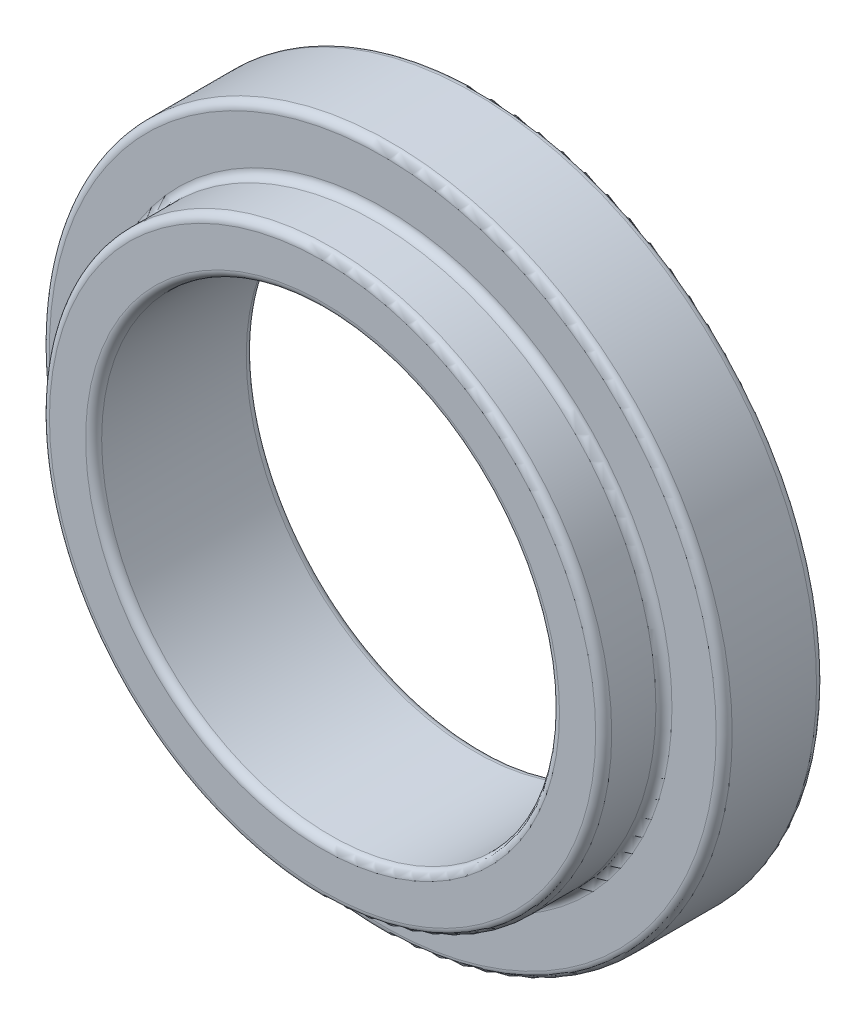
from build123d import *

# Parameters (mm, degrees)
SKETCH_1_R          = 85
EXTRUDE_1_DEPTH     = 40
SKETCH_2_R          = 57
CUT_EXTRUDE_1_DEPTH = 127.688594593
CUT_EXTRUDE_START   = -15
SKETCH_3_R          = 85
SKETCH_3_R_2        = 70
CUT_EXTRUDE_2_DEPTH = 15
FILLET_1_R          = 2


with BuildPart() as part:
    # 草图1 → 凸台-拉伸1 (new body)
    with BuildSketch(Plane.XY):
        Circle(SKETCH_1_R)
    extrude(amount=EXTRUDE_1_DEPTH)

    # 草图2 → 切除-拉伸1 (cut, through all)
    with BuildSketch(Plane.XY.offset(40)):
        Circle(SKETCH_2_R)
    extrude(amount=-CUT_EXTRUDE_1_DEPTH, mode=Mode.SUBTRACT)

    # 草图3 → 切除-拉伸2 (cut)
    with BuildSketch(Plane.XY.offset(40).offset(CUT_EXTRUDE_START)):
        Circle(SKETCH_3_R)
        Circle(SKETCH_3_R_2, mode=Mode.SUBTRACT)
    extrude(amount=CUT_EXTRUDE_2_DEPTH, mode=Mode.SUBTRACT)

    # 圆角1
    fillet_1_edges = [part.edges().sort_by_distance(p)[0] for p in [
        (-85, 0, 25),
        (-70, 0, 25),
        (-70, 0, 40),
        (-85, 0, 0),
        (-57, 0, 0),
        (-57, 0, 40),
    ]]
    fillet(fillet_1_edges, radius=FILLET_1_R)


solid = part.part
